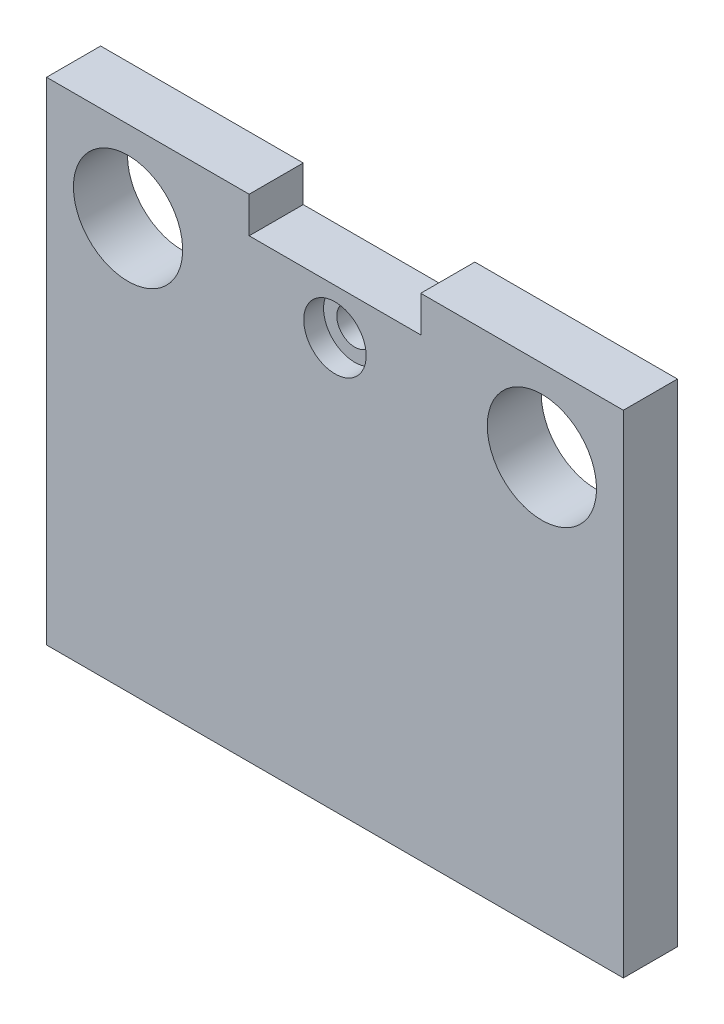
from build123d import *

# Parameters (mm, degrees)
SKETCH1_W                = 203.2
SKETCH1_H                = 304.8
BOSS_EXTRUDE1_DEPTH      = 19.05
ESQUISSE2_W              = 203.2
ESQUISSE2_H              = 38.1
ENL_V_MAT_EXTRU_2_DEPTH  = 367.819005097
ESQUISSE3_W              = 203.2
ESQUISSE3_H              = 93.472
ENL_V_MAT_EXTRU_3_DEPTH  = 336.830362683
ESQUISSE5_R              = 19.2405
ENL_V_MAT_EXTRU_5_DEPTH  = 268.695876853
ESQUISSE9_R              = 10.9982
ENL_V_MAT_EXTRU_9_DEPTH  = 6.985
ESQUISSE10_R             = 6.35
ENL_V_MAT_EXTRU_10_DEPTH = 268.289626078
ESQUISSE11_W             = 60.452
ESQUISSE11_H             = 12.7
ENL_V_MAT_EXTRU_11_DEPTH = 19.05


with BuildPart() as part:
    # Sketch1 → Boss-Extrude1 (new body)
    with BuildSketch(Plane.XY):
        with Locations((101.6, 152.4)):
            Rectangle(SKETCH1_W, SKETCH1_H)
    extrude(amount=BOSS_EXTRUDE1_DEPTH)

    # Esquisse2 → Enlèv. mat.-Extru.2 (cut, through all)
    with BuildSketch(Plane(origin=(0, 0, 0), x_dir=(-1, 0, 0), z_dir=(0, 0, -1))):
        with Locations((-101.6, 285.75)):
            Rectangle(ESQUISSE2_W, ESQUISSE2_H)
    extrude(amount=-ENL_V_MAT_EXTRU_2_DEPTH, mode=Mode.SUBTRACT)

    # Esquisse3 → Enlèv. mat.-Extru.3 (cut, through all)
    with BuildSketch(Plane(origin=(0, 0, 0), x_dir=(-1, 0, 0), z_dir=(0, 0, -1))):
        with Locations((-101.6, 219.964)):
            Rectangle(ESQUISSE3_W, ESQUISSE3_H)
    extrude(amount=-ENL_V_MAT_EXTRU_3_DEPTH, mode=Mode.SUBTRACT)

    # Esquisse5 → Enlèv. mat.-Extru.5 (cut, through all)
    with BuildSketch(Plane(origin=(0, 0, 0), x_dir=(-1, 0, 0), z_dir=(0, 0, -1))):
        with Locations((-174.498, 144.526)):
            Circle(ESQUISSE5_R)
        with Locations((-28.702, 144.526)):
            Circle(ESQUISSE5_R)
    extrude(amount=-ENL_V_MAT_EXTRU_5_DEPTH, mode=Mode.SUBTRACT)

    # Esquisse9 → Enlèv. mat.-Extru.9 (cut)
    with BuildSketch(Plane.XY.offset(19.05)):
        with Locations((101.6, 144.526)):
            Circle(ESQUISSE9_R)
    extrude(amount=-ENL_V_MAT_EXTRU_9_DEPTH, mode=Mode.SUBTRACT)

    # Esquisse10 → Enlèv. mat.-Extru.10 (cut, through all)
    with BuildSketch(Plane.XY.offset(12.065)):
        with Locations((101.6, 144.526)):
            Circle(ESQUISSE10_R)
    extrude(amount=-ENL_V_MAT_EXTRU_10_DEPTH, mode=Mode.SUBTRACT)

    # Esquisse11 → Enlèv. mat.-Extru.11 (cut)
    with BuildSketch(Plane(origin=(0, 0, 0), x_dir=(-1, 0, 0), z_dir=(0, 0, -1))):
        with Locations((-101.6, 166.878)):
            Rectangle(ESQUISSE11_W, ESQUISSE11_H)
    extrude(amount=-ENL_V_MAT_EXTRU_11_DEPTH, mode=Mode.SUBTRACT)


solid = part.part
